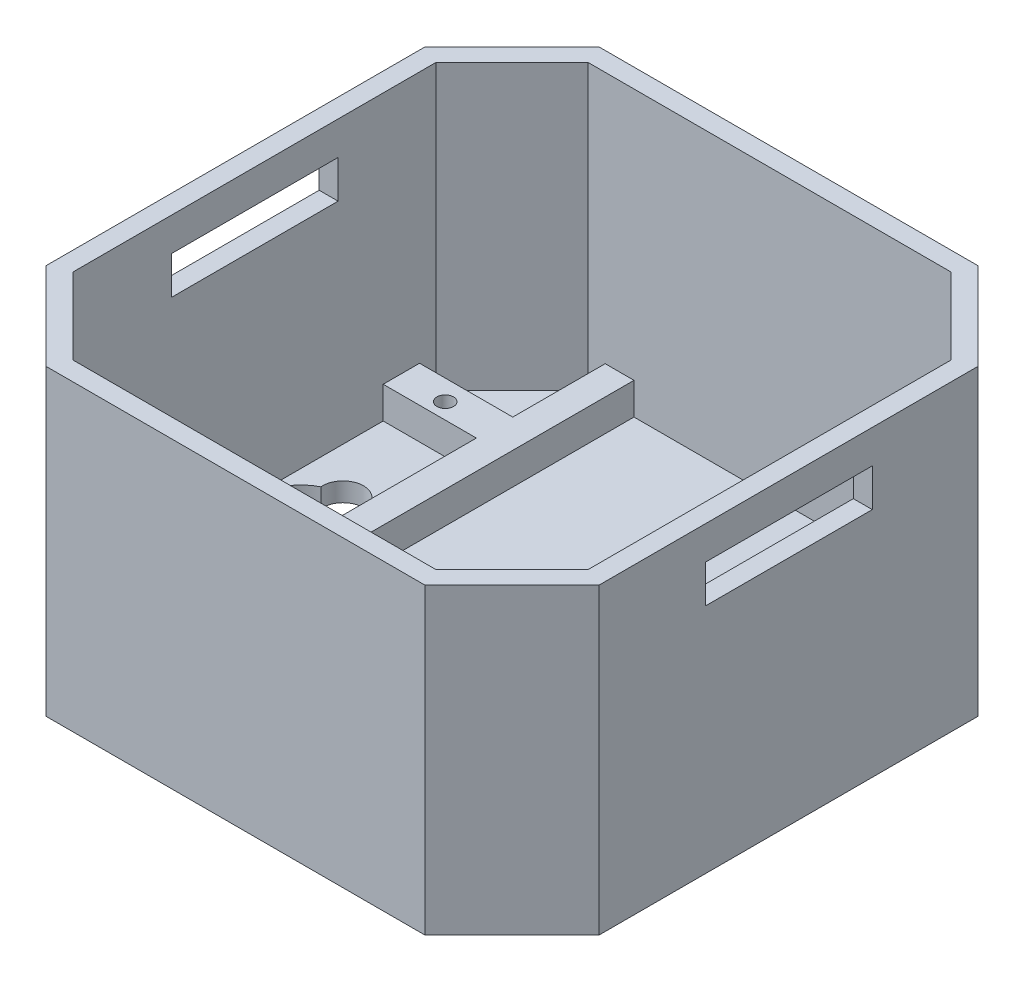
from build123d import *

# Parameters (mm, degrees)
SALIENTE_EXTRUIR1_DEPTH = 40
VACIADO1_T              = -2.5
CROQUIS5_W              = 22
CROQUIS5_H              = 5
CORTAR_EXTRUIR1_DEPTH   = 91.891418737
CORTAR_EXTRUIR2_DEPTH   = 10
SALIENTE_EXTRUIR4_DEPTH = 4.2
CROQUIS9_W              = 12.3
CROQUIS9_H              = 5
CORTAR_EXTRUIR3_DEPTH   = 64.802429421
CROQUIS10_R             = 6
CORTAR_EXTRUIR4_DEPTH   = 4
CROQUIS11_R             = 2.75
CORTAR_EXTRUIR5_DEPTH   = 4
CROQUIS12_R             = 1.1
CORTAR_EXTRUIR6_DEPTH   = 6


with BuildPart() as part:
    # Croquis3 → Saliente-Extruir1 (new body)
    with BuildSketch(Plane(origin=(0, 0, 0), x_dir=(1, 0, 0), z_dir=(0, 1, 0))):
        Polygon((-25, -36.5), (25, -36.5), (36.5, -25), (36.5, 25), (25, 36.5), (-25, 36.5), (-36.5, 25), (-36.5, -25), align=None)
    extrude(amount=SALIENTE_EXTRUIR1_DEPTH)

    # Vaciado1
    vaciado1_openings = [part.faces().sort_by_distance(p)[0] for p in [
        (0, 40, 0),
    ]]
    offset(amount=VACIADO1_T, openings=vaciado1_openings, kind=Kind.INTERSECTION)

    # Croquis5 → Cortar-Extruir1 (cut, through all)
    with BuildSketch(Plane.ZY.offset(36.5)):
        with Locations((-0.05, 33.1)):
            Rectangle(CROQUIS5_W, CROQUIS5_H)
    extrude(amount=-CORTAR_EXTRUIR1_DEPTH, mode=Mode.SUBTRACT)

    # Croquis6 → Cortar-Extruir2 (cut)
    with BuildSketch(Plane.XZ):
        with BuildLine():
            ThreePointArc((-25.210387191, -5.363392857), (-27.9, 6), (-30.589612809, -5.363392857))
            ThreePointArc((-30.589612809, -5.363392857), (-27.9, -8.3), (-25.210387191, -5.363392857))
        make_face()
        with BuildLine():
            ThreePointArc((30.589612809, -5.363392857), (27.9, -8.3), (25.210387191, -5.363392857))
            ThreePointArc((25.210387191, -5.363392857), (27.9, 6), (30.589612809, -5.363392857))
        make_face()
    extrude(amount=-CORTAR_EXTRUIR2_DEPTH, mode=Mode.SUBTRACT)

    # Croquis7 → Saliente-Extruir4 (add)
    with BuildSketch(Plane(origin=(0, 2.5, 0), x_dir=(1, 0, 0), z_dir=(0, 1, 0))):
        Polygon((-21.7, 0), (-21.7, 17), (-34, 17), (-34, 21.8), (-21.7, 21.8), (-21.7, 34), (-17.9, 34), (-17.9, -34), (-21.7, -34), (-23.964466094, -34), (-34, -23.964466094), (-34, -19.8), (-34, -15.8), (-21.7, -15.8), (-21.7, -10.8), (-34, -10.8), (-34, -6), (-21.7, -6), align=None)
        Polygon((21.7, -19.8), (21.7, -34), (17.9, -34), (17.9, 34), (21.7, 34), (21.7, 21.8), (34, 21.8), (34, 17), (21.7, 17), (21.7, 0), (21.7, -6), (34, -6), (34, -10.8), (21.7, -10.8), (21.7, -15.8), (34, -15.8), (34, -19.8), align=None)
    extrude(amount=SALIENTE_EXTRUIR4_DEPTH)

    # Croquis9 → Cortar-Extruir3 (cut, through all)
    with BuildSketch(Plane(origin=(0, 2.5, 0), x_dir=(1, 0, 0), z_dir=(0, 1, 0))):
        with Locations((-27.85, -13.3)):
            Rectangle(CROQUIS9_W, CROQUIS9_H)
        with Locations((27.85, -13.3)):
            Rectangle(CROQUIS9_W, CROQUIS9_H)
    extrude(amount=-CORTAR_EXTRUIR3_DEPTH, mode=Mode.SUBTRACT)

    # Croquis10 → Cortar-Extruir4 (cut)
    with BuildSketch(Plane(origin=(0, 6.7, 0), x_dir=(1, 0, 0), z_dir=(0, 1, 0))):
        with Locations(Location((-24.9, -22.8, 0), (0, 0, 270))):
            Circle(CROQUIS10_R)
    extrude(amount=-CORTAR_EXTRUIR4_DEPTH, mode=Mode.SUBTRACT)

    # Croquis11 → Cortar-Extruir5 (cut)
    with BuildSketch(Plane(origin=(0, 2.7, 0), x_dir=(1, 0, 0), z_dir=(0, 1, 0))):
        with Locations(Location((-24.9, -22.8, 0), (0, 0, 270))):
            Circle(CROQUIS11_R)
    extrude(amount=-CORTAR_EXTRUIR5_DEPTH, mode=Mode.SUBTRACT)

    # Croquis12 → Cortar-Extruir6 (cut)
    with BuildSketch(Plane(origin=(0, 6.7, 0), x_dir=(1, 0, 0), z_dir=(0, 1, 0))):
        with Locations(Location((-27.91, 19.1, 0), (0, 0, 270))):
            Circle(CROQUIS12_R)
        with Locations(Location((-27.91, -8.7, 0), (0, 0, 270))):
            Circle(CROQUIS12_R)
        with Locations(Location((27.91, -8.7, 0), (0, 0, 90))):
            Circle(CROQUIS12_R)
        with Locations(Location((27.91, 19.1, 0), (0, 0, 90))):
            Circle(CROQUIS12_R)
    extrude(amount=-CORTAR_EXTRUIR6_DEPTH, mode=Mode.SUBTRACT)


solid = part.part
